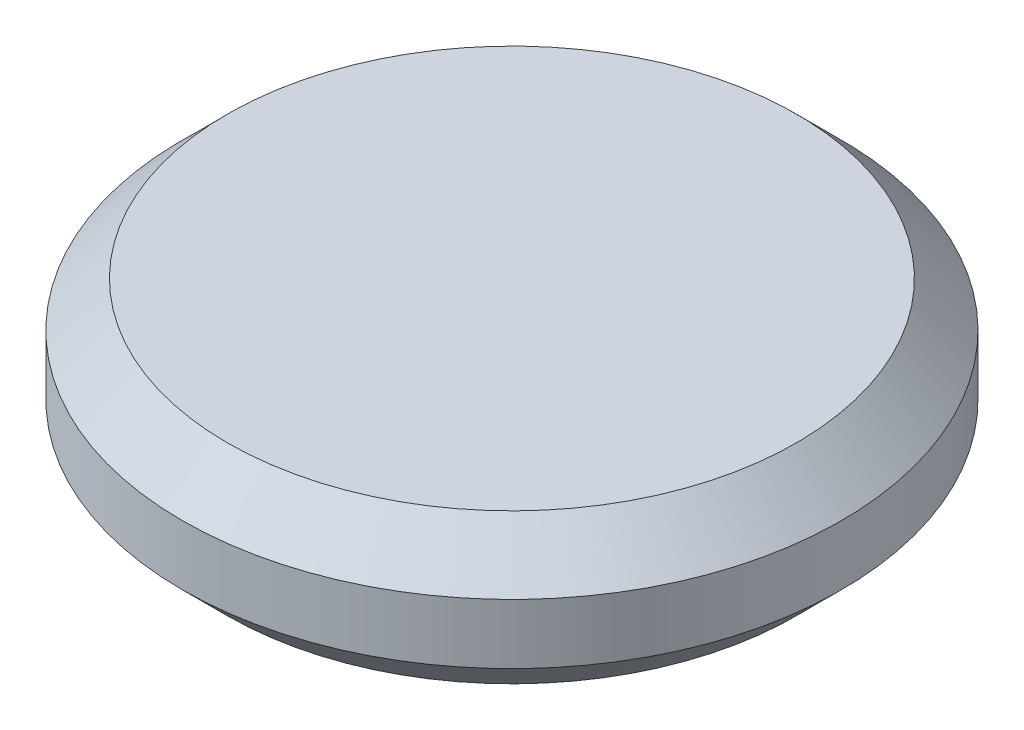
from build123d import *

# Parameters (mm, degrees)
SKETCH2_R           = 110
BOSS_EXTRUDE1_DEPTH = 50
CHAMFER1_SIZE       = 15
SCALE1_SCALE        = 0.333333333


with BuildPart() as part:
    # Sketch2 → Boss-Extrude1 (new body)
    with BuildSketch(Plane(origin=(0, 0, 0), x_dir=(1, 0, 0), z_dir=(0, 1, 0))):
        with Locations(Location((0, 0, 0), (0, 0, 270))):
            Circle(SKETCH2_R)
    extrude(amount=BOSS_EXTRUDE1_DEPTH)

    # Chamfer1
    chamfer1_edges = [part.edges().sort_by_distance(p)[0] for p in [
        (0, 0, -110),
        (0, 50, -110),
    ]]
    chamfer(chamfer1_edges, length=CHAMFER1_SIZE)


with BuildPart() as part_1:
    # Scale1: scaled about (0, 0, 0)
    add(part.part.scale(SCALE1_SCALE))


solid = part_1.part
